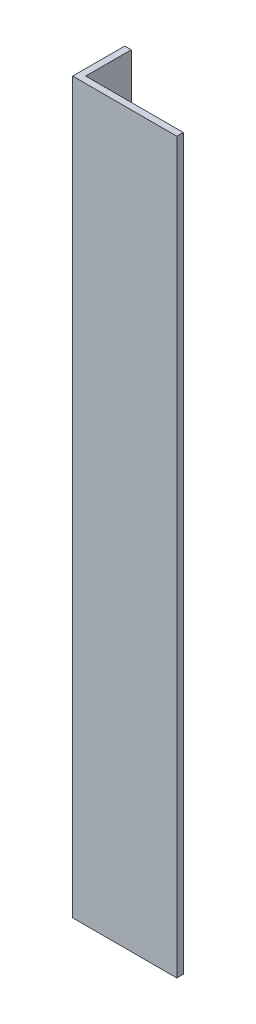
from build123d import *

# Parameters (mm, degrees)
BOSS_EXTRUDE1_DEPTH = 355.6


with BuildPart() as part:
    # Sketch1 → Boss-Extrude1 (new body)
    with BuildSketch(Plane(origin=(0, 0, 0), x_dir=(1, 0, 0), z_dir=(0, 1, 0))):
        Polygon((3.175, 3.175), (3.175, 25.4), (0, 25.4), (0, 0), (50.8, 0), (50.8, 3.175), align=None)
    extrude(amount=BOSS_EXTRUDE1_DEPTH)


solid = part.part
